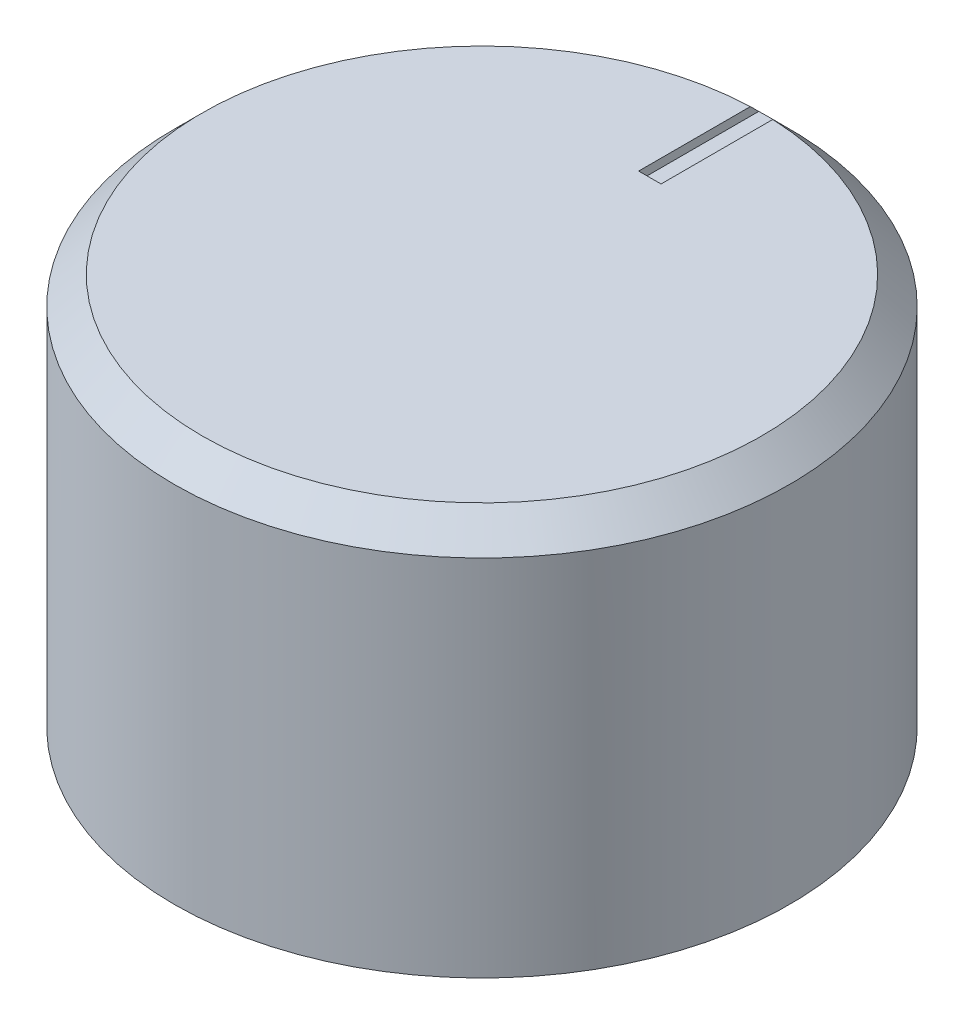
from build123d import *

# Parameters (mm, degrees)
SKETCH1_R           = 11
BOSS_EXTRUDE1_DEPTH = 14
CHAMFER1_SIZE       = 1
SKETCH3_W           = 0.8
SKETCH3_H           = 5
CUT_EXTRUDE1_DEPTH  = 0.3
SKETCH4_R           = 3
CUT_EXTRUDE2_DEPTH  = 10


with BuildPart() as part:
    # Sketch1 → Boss-Extrude1 (new body)
    with BuildSketch(Plane(origin=(0, 0, 0), x_dir=(1, 0, 0), z_dir=(0, 1, 0))):
        with Locations(Location((0, 0, 0), (0, 0, 270))):
            Circle(SKETCH1_R)
    extrude(amount=BOSS_EXTRUDE1_DEPTH)

    # Chamfer1
    chamfer1_edges = [part.edges().sort_by_distance(p)[0] for p in [
        (0, 14, -11),
    ]]
    chamfer(chamfer1_edges, length=CHAMFER1_SIZE)

    # Sketch3 → Cut-Extrude1 (cut)
    with BuildSketch(Plane(origin=(0, 14, 0), x_dir=(1, 0, 0), z_dir=(0, 1, 0))):
        with Locations((0, 8.5)):
            Rectangle(SKETCH3_W, SKETCH3_H)
    extrude(amount=-CUT_EXTRUDE1_DEPTH, mode=Mode.SUBTRACT)

    # Sketch4 → Cut-Extrude2 (cut)
    with BuildSketch(Plane.XZ):
        with Locations(Location((0, 0, 0), (0, 0, 270))):
            Circle(SKETCH4_R)
    extrude(amount=-CUT_EXTRUDE2_DEPTH, mode=Mode.SUBTRACT)


solid = part.part
